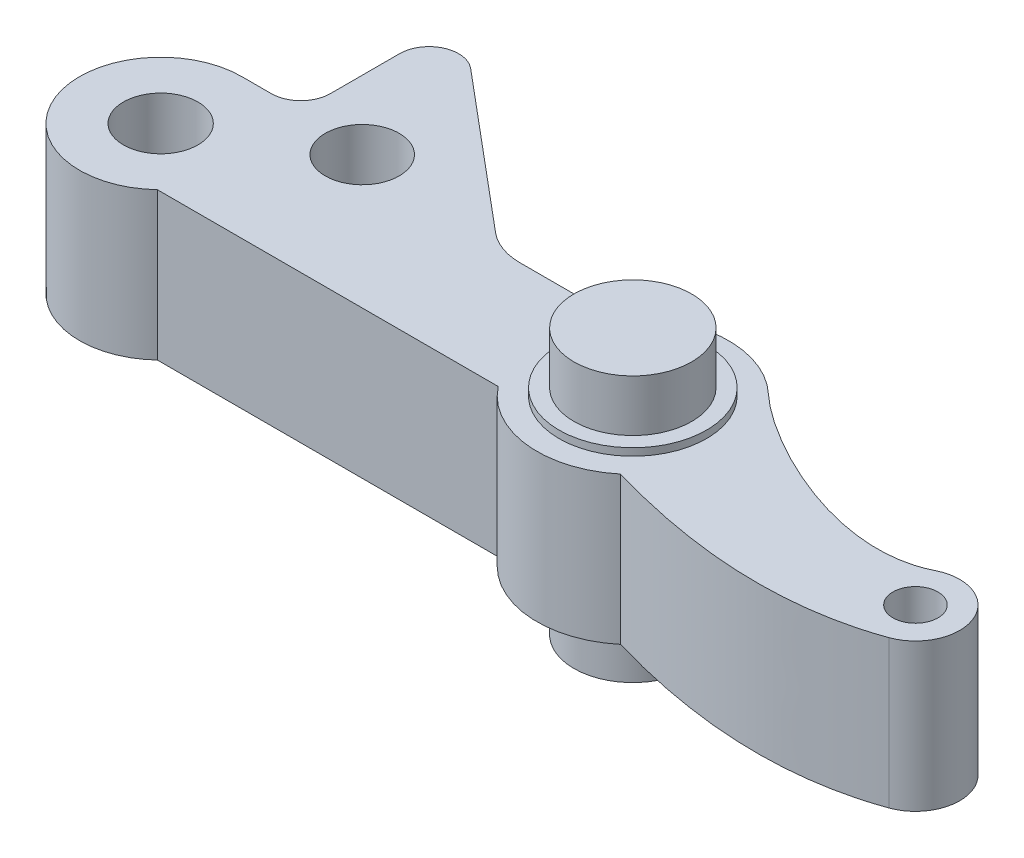
from build123d import *

# Parameters (mm, degrees)
SKETCH_1_R      = 2.525
SKETCH_1_R_2    = 2.505
EXTRUDE_1_DEPTH = 10
SKETCH_2_R      = 1.525
EXTRUDE_2_DEPTH = 5
SKETCH_5_R      = 3.99
EXTRUDE_4_DEPTH = 9
FILLET_1_R      = 4
FILLET_2_R      = 2
FILLET_3_R      = 2
SKETCH_6_R      = 5
EXTRUDE_5_DEPTH = 0.5


with BuildPart() as part:
    # 草图1 → 凸台-拉伸1 (new body)
    with BuildSketch(Plane(origin=(0, 0, 0), x_dir=(1, 0, 0), z_dir=(0, 1, 0))):
        with BuildLine():
            Line((-5.123475383, -4), (-28.225082782, -4))
            ThreePointArc((-28.225082782, -4), (-37.111262075, -2.031009601), (-32, 5.5))
            Line((-32, 5.5), (-28, 5.5))
            Line((-28, 5.5), (-28, 16.482886319))
            Line((-28, 16.482886319), (-13.123475383, 4))
            Line((-13.123475383, 4), (-5.123475383, 4))
            ThreePointArc((-5.123475383, 4), (6.5, 0), (-5.123475383, -4))
        make_face()
        with Locations(Location((-32, 0, 0), (0, 0, 270))):
            Circle(SKETCH_1_R, mode=Mode.SUBTRACT)
        with Locations(Location((-23.339745962, 5, 0), (0, 0, 270))):
            Circle(SKETCH_1_R_2, mode=Mode.SUBTRACT)
    extrude(amount=EXTRUDE_1_DEPTH)

    # 草图2 → 凸台-拉伸2 (add, symmetric)
    with BuildSketch(Plane(origin=(0, 5, 0), x_dir=(1, 0, 0), z_dir=(0, 1, 0))):
        with BuildLine():
            ThreePointArc((4.159420521, -4.994919512), (6.496753335, -0.205416905), (4.466659496, 4.722176717))
            add(Edge.make_bspline(
                [(4.466659496, 4.722176717), (7.284864094, 2.056465312), (15.716737601, -2.396247552), (20.490071148, 0)],
                knots=[0, 0, 0, 0, 1, 1, 1, 1], degree=3))
            ThreePointArc((20.490071148, 0), (24.593372298, -1.499185377), (22.849655998, -5.50469291))
            add(Edge.make_bspline(
                [(4.159420521, -4.994919512), (15.25095487, -8.232572742), (22.849655998, -5.50469291)],
                knots=[0, 0, 0, 1, 1, 1], degree=2))
        make_face()
        with Locations(Location((21.836015336, -2.681125555, 0), (0, 0, 90))):
            Circle(SKETCH_2_R, mode=Mode.SUBTRACT)
    extrude(amount=EXTRUDE_2_DEPTH, both=True)

    # 草图5 → 凸台-拉伸4 (add, symmetric)
    with BuildSketch(Plane(origin=(0, 5, 0), x_dir=(1, 0, 0), z_dir=(0, 1, 0))):
        with Locations(Location((0, 0, 0), (0, 0, 270))):
            Circle(SKETCH_5_R)
    extrude(amount=EXTRUDE_4_DEPTH, both=True)

    # 圆角1
    fillet_1_edges = [part.edges().sort_by_distance(p)[0] for p in [
        (-13.123475383, 5, -4),
    ]]
    fillet(fillet_1_edges, radius=FILLET_1_R)

    # 圆角2
    fillet_2_edges = [part.edges().sort_by_distance(p)[0] for p in [
        (-28, 5, -16.482886319),
    ]]
    fillet(fillet_2_edges, radius=FILLET_2_R)

    # 圆角3
    fillet_3_edges = [part.edges().sort_by_distance(p)[0] for p in [
        (-28, 5, -5.5),
    ]]
    fillet(fillet_3_edges, radius=FILLET_3_R)

    # 草图6 → 凸台-拉伸5 (add)
    with BuildSketch(Plane(origin=(0, 10, 0), x_dir=(1, 0, 0), z_dir=(0, 1, 0))):
        with Locations(Location((0, 0, 0), (0, 0, 270))):
            Circle(SKETCH_6_R)
    extrude_5 = extrude(amount=EXTRUDE_5_DEPTH)

    # 镜向1: 凸台-拉伸5 across plane
    add(extrude_5.mirror(Plane.ZX.offset(5)))


solid = part.part
